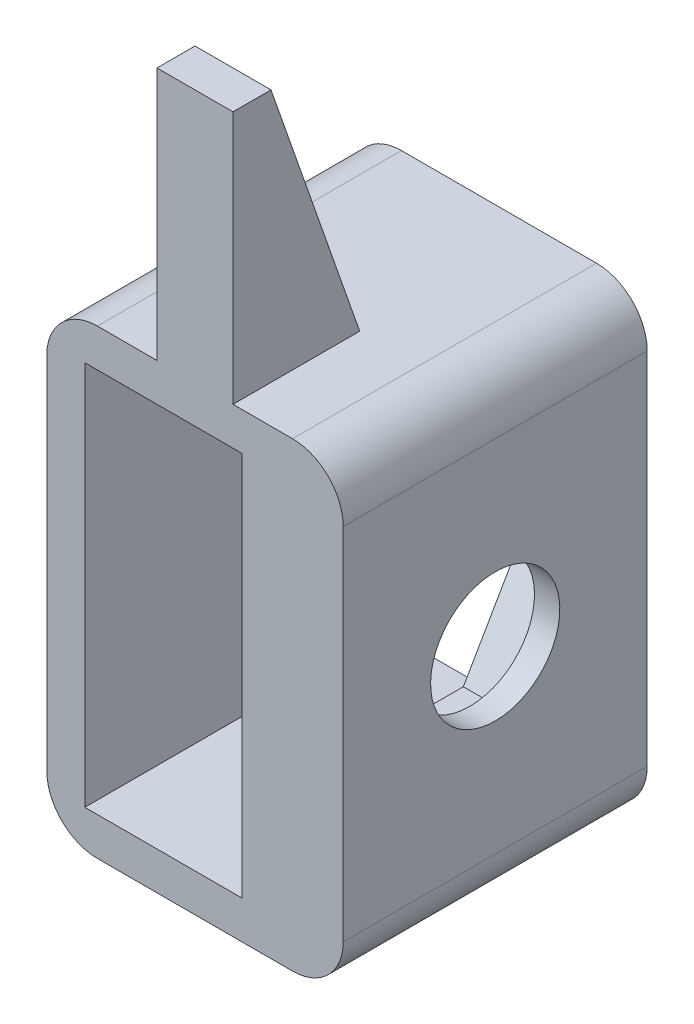
from build123d import *

# Parameters (mm, degrees)
SKETCH1_W           = 11.7
SKETCH1_H           = 18.2
SKETCH1_W_2         = 6.2
SKETCH1_H_2         = 15.2
BOSS_EXTRUDE1_DEPTH = 12
SKETCH4_R           = 2.55
CUT_EXTRUDE1_DEPTH  = 3
SKETCH4_3_R         = 2.55
CUT_EXTRUDE2_DEPTH  = 17.914490829
SKETCH7_W           = 3
SKETCH7_H           = 1.5
BOSS_EXTRUDE3_DEPTH = 10
FILLET1_R           = 2
RIB6_REACH          = 25.303
SKETCH5_WALL_W      = 59.200925528
SKETCH5_WALL_H      = 3


with BuildPart() as part:
    # Sketch1 → Boss-Extrude1 (new body)
    with BuildSketch(Plane.XY):
        with Locations((1.25, 0)):
            Rectangle(SKETCH1_W, SKETCH1_H)
        Rectangle(SKETCH1_W_2, SKETCH1_H_2, mode=Mode.SUBTRACT)
    extrude(amount=BOSS_EXTRUDE1_DEPTH)

    # Sketch4 → Cut-Extrude1 (cut)
    with BuildSketch(Plane.ZY.offset(-3.1)):
        Polygon((0.515172443, 0), (3.257586221, -4.75), (8.742413779, -4.75), (11.484827557, 0), (8.742413779, 4.75), (3.257586221, 4.75), align=None)
        with Locations(Location((6, 0, 0), (0, 0, 270))):
            Circle(SKETCH4_R, mode=Mode.SUBTRACT)
    extrude(amount=-CUT_EXTRUDE1_DEPTH, mode=Mode.SUBTRACT)

    # Sketch4<3> → Cut-Extrude2 (cut, through all)
    with BuildSketch(Plane.ZY.offset(-3.1)):
        with Locations(Location((6, 0, 0), (0, 0, 270))):
            Circle(SKETCH4_3_R)
    extrude(amount=-CUT_EXTRUDE2_DEPTH, mode=Mode.SUBTRACT)

    # Sketch7 → Boss-Extrude3 (add)
    with BuildSketch(Plane(origin=(0, 9.1, 0), x_dir=(1, 0, 0), z_dir=(0, 1, 0))):
        with Locations((1.25, -11.25)):
            Rectangle(SKETCH7_W, SKETCH7_H)
    extrude(amount=BOSS_EXTRUDE3_DEPTH)

    # Fillet1
    fillet1_edges = [part.edges().sort_by_distance(p)[0] for p in [
        (7.1, 9.1, 6),
        (-4.6, 9.1, 6),
        (7.1, -9.1, 6),
        (-4.6, -9.1, 6),
    ]]
    fillet(fillet1_edges, radius=FILLET1_R)

    # Sketch5 wall → Rib6 (add, up to next)
    with BuildSketch(Plane(origin=(1.25, 14.1, 8.75), x_dir=(0, 0.943858356366, 0.330350424728), z_dir=(0, -0.330350424728, 0.943858356366)), mode=Mode.PRIVATE) as rib6_sk1:
        Rectangle(SKETCH5_WALL_W, SKETCH5_WALL_H)
    rib6_tool1 = extrude(rib6_sk1.sketch, amount=RIB6_REACH, mode=Mode.PRIVATE) - part.part
    add(rib6_tool1.solids().sort_by_distance((1.25, 14.1, 8.75))[0])


solid = part.part
